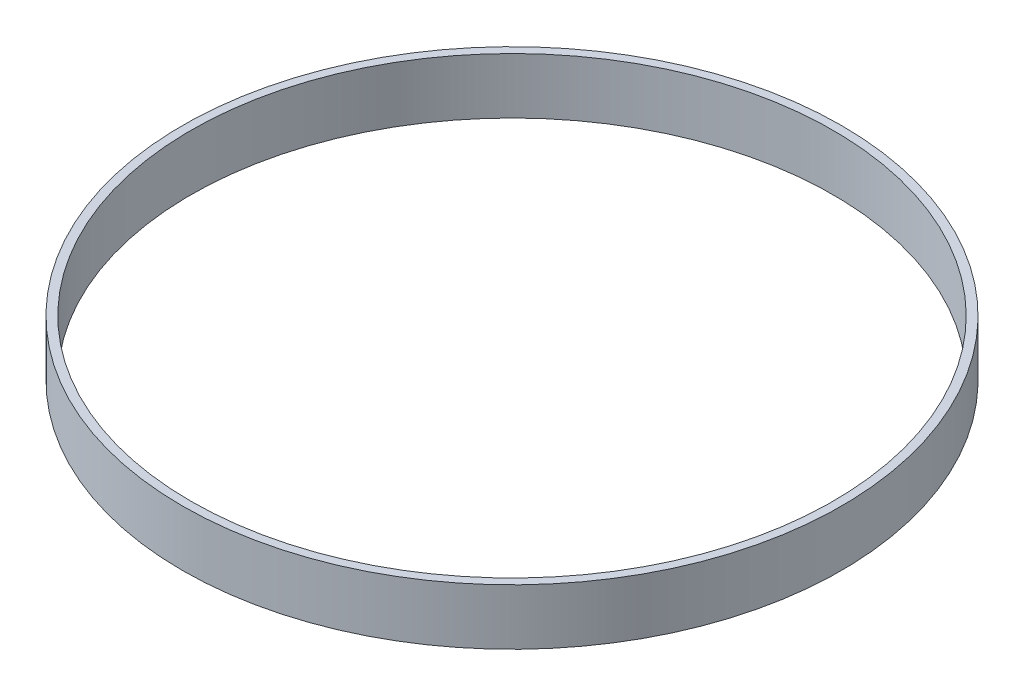
from build123d import *

# Parameters (mm, degrees)
SKETCH_1_R      = 59
SKETCH_1_R_2    = 57.5
EXTRUDE_1_DEPTH = 10


with BuildPart() as part:
    # 草图1 → 凸台-拉伸1 (new body)
    with BuildSketch(Plane(origin=(0, 0, 0), x_dir=(1, 0, 0), z_dir=(0, 1, 0))):
        with Locations(Location((0, 0, 0), (0, 0, 270))):
            Circle(SKETCH_1_R)
        with Locations(Location((0, 0, 0), (0, 0, 270))):
            Circle(SKETCH_1_R_2, mode=Mode.SUBTRACT)
    extrude(amount=EXTRUDE_1_DEPTH)


solid = part.part
